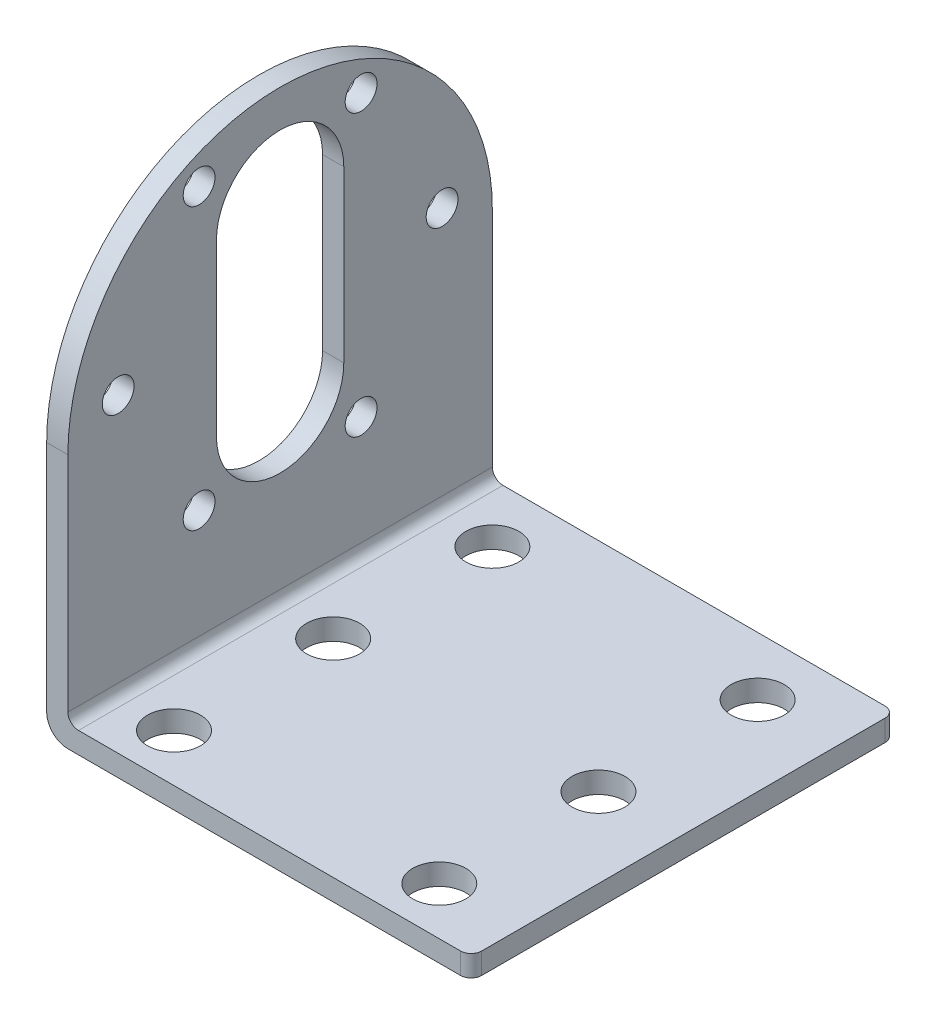
from build123d import *

# Parameters (mm, degrees)
BOSS_EXTRUDE1_DEPTH = 40
HOLE1_D             = 5
CUT_EXTRUDE1_DEPTH  = 40
CUT_EXTRUDE2_DEPTH  = 40
SKETCH7_R           = 1.5
CUT_EXTRUDE3_DEPTH  = 40
FILLET1_R           = 1
SKETCH10_R          = 2.5
CUT_EXTRUDE4_DEPTH  = 40


with BuildPart() as part:
    # Sketch2 → Boss-Extrude1 (new body)
    with BuildSketch(Plane.XY):
        with BuildLine():
            Line((2, 0), (40, 0))
            Line((40, 0), (40, 2))
            Line((40, 2), (3, 2))
            ThreePointArc((3, 2), (2.292893219, 2.292893219), (2, 3))
            Line((2, 3), (2, 45))
            Line((2, 45), (0, 45))
            Line((0, 45), (0, 2))
            ThreePointArc((0, 2), (0.585786438, 0.585786438), (2, 0))
        make_face()
    extrude(amount=BOSS_EXTRUDE1_DEPTH)

    # Hole1 (through all)
    with Locations(Plane(origin=(0, 2, 0), x_dir=(1, 0, 0), z_dir=(0, 1, 0))):
        with Locations((32.5, -35.5), (32.5, -5.5), (7.5, -5.5), (7.5, -35.5)):
            Hole(HOLE1_D / 2)

    # Sketch5 → Cut-Extrude1 (cut)
    with BuildSketch(Plane(origin=(2, 0, 0), x_dir=(0, 0, -1), z_dir=(1, 0, 0))):
        with BuildLine():
            Line((-40, 45), (-40, 24))
            ThreePointArc((-40, 24), (-20, 44), (0, 24))
            Line((0, 24), (0, 45))
            Line((0, 45), (-40, 45))
        make_face()
    extrude(amount=-CUT_EXTRUDE1_DEPTH, mode=Mode.SUBTRACT)

    # Sketch6 → Cut-Extrude2 (cut)
    with BuildSketch(Plane(origin=(2, 0, 0), x_dir=(0, 0, -1), z_dir=(1, 0, 0))):
        with BuildLine():
            Line((-14, 34.5), (-14, 18.5))
            ThreePointArc((-14, 18.5), (-20, 12.5), (-26, 18.5))
            Line((-26, 18.5), (-26, 34.5))
            ThreePointArc((-26, 34.5), (-20, 40.5), (-14, 34.5))
        make_face()
    extrude(amount=-CUT_EXTRUDE2_DEPTH, mode=Mode.SUBTRACT)

    # Sketch7 → Cut-Extrude3 (cut)
    with BuildSketch(Plane(origin=(2, 0, 0), x_dir=(0, 0, -1), z_dir=(1, 0, 0))):
        with Locations((-4.735, 26.5)):
            Circle(SKETCH7_R)
        with Locations((-35.265, 26.5)):
            Circle(SKETCH7_R)
        with Locations((-27.6325, 13.280122211)):
            Circle(SKETCH7_R)
        with Locations((-12.3675, 13.280122211)):
            Circle(SKETCH7_R)
        with Locations((-27.6325, 39.719877789)):
            Circle(SKETCH7_R)
        with Locations((-12.3675, 39.719877789)):
            Circle(SKETCH7_R)
    extrude(amount=-CUT_EXTRUDE3_DEPTH, mode=Mode.SUBTRACT)

    # Fillet1
    fillet1_edges = [part.edges().sort_by_distance(p)[0] for p in [
        (40, 1, 0),
        (40, 1, 40),
    ]]
    fillet(fillet1_edges, radius=FILLET1_R)

    # Sketch10 → Cut-Extrude4 (cut)
    with BuildSketch(Plane(origin=(0, 2, 0), x_dir=(1, 0, 0), z_dir=(0, 1, 0))):
        with Locations(Location((7.5, -20.5, 0), (0, 0, 270))):
            Circle(SKETCH10_R)
        with Locations(Location((32.5, -20.5, 0), (0, 0, 270))):
            Circle(SKETCH10_R)
    extrude(amount=-CUT_EXTRUDE4_DEPTH, mode=Mode.SUBTRACT)


solid = part.part
